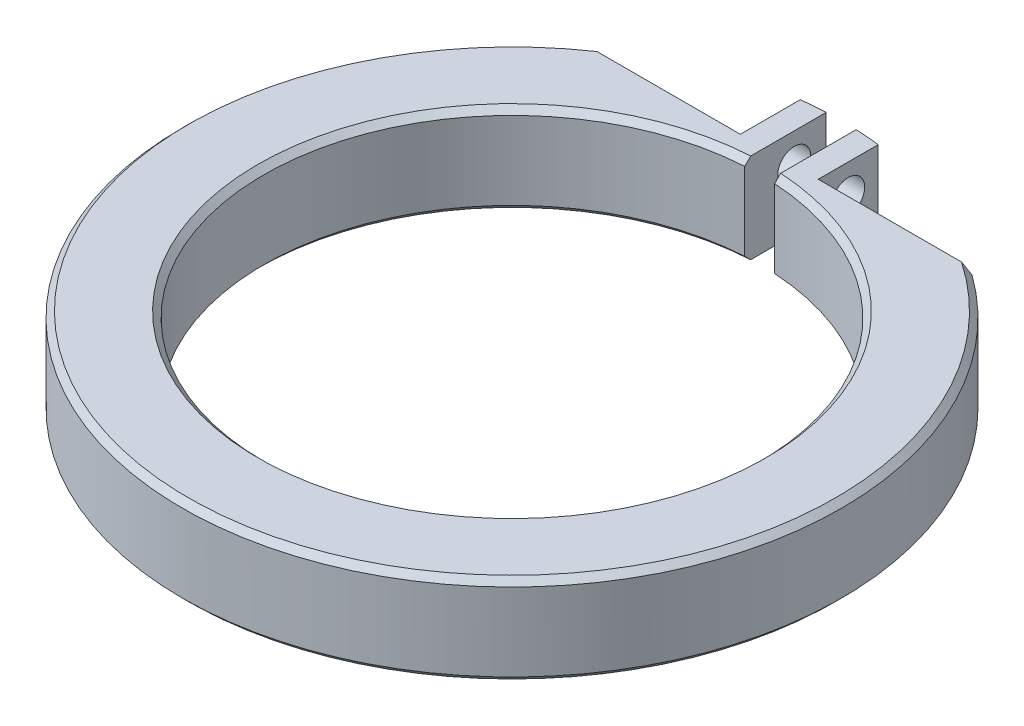
from build123d import *

# Parameters (mm, degrees)
SKETCH1_R           = 55
SKETCH1_R_2         = 41.4175
BOSS_EXTRUDE1_DEPTH = 15
CUT_EXTRUDE1_DEPTH  = 80.214897589
CUT_EXTRUDE2_START  = -10
CUT_EXTRUDE2_DEPTH  = 10
SKETCH4_R           = 2.75
CUT_EXTRUDE3_DEPTH  = 84.858511792
FILLET2_R           = 2
CHAMFER2_SIZE       = 1
CHAMFER3_SIZE       = 1


with BuildPart() as part:
    # Sketch1 → Boss-Extrude1 (new body)
    with BuildSketch(Plane(origin=(0, 0, 0), x_dir=(1, 0, 0), z_dir=(0, 1, 0))):
        with Locations(Location((0, 0, 0), (0, 0, 270))):
            Circle(SKETCH1_R)
        with Locations(Location((0, 0, 0), (0, 0, 270))):
            Circle(SKETCH1_R_2, mode=Mode.SUBTRACT)
    extrude(amount=BOSS_EXTRUDE1_DEPTH)

    # Sketch2 → Cut-Extrude1 (cut, through all)
    with BuildSketch(Plane(origin=(0, 15, 0), x_dir=(1, 0, 0), z_dir=(0, 1, 0))):
        with BuildLine():
            Line((-2.5, 41.341979951), (-2.5, 54.94315244))
            ThreePointArc((-2.5, 54.94315244), (0, 55), (2.5, 54.94315244))
            Line((2.5, 54.94315244), (2.5, 41.341979951))
            ThreePointArc((2.5, 41.341979951), (0, 41.4175), (-2.5, 41.341979951))
        make_face()
    extrude(amount=-CUT_EXTRUDE1_DEPTH, mode=Mode.SUBTRACT)

    # Sketch3 → Cut-Extrude2 (cut)
    with BuildSketch(Plane(origin=(0, 15, 0), x_dir=(1, 0, 0), z_dir=(0, 1, 0)).offset(CUT_EXTRUDE2_START)):
        with BuildLine():
            Line((-6.5, 54.614558499), (-6.5, 44.614558499))
            Line((-6.5, 44.614558499), (-32.164284074, 44.614558499))
            ThreePointArc((-32.164284074, 44.614558499), (-19.96826772, 51.247129522), (-6.5, 54.614558499))
        make_face()
        with BuildLine():
            Line((6.5, 44.614558499), (32.164284074, 44.614558499))
            ThreePointArc((32.164284074, 44.614558499), (19.96826772, 51.247129522), (6.5, 54.614558499))
            Line((6.5, 54.614558499), (6.5, 44.614558499))
        make_face()
    extrude(amount=CUT_EXTRUDE2_DEPTH, mode=Mode.SUBTRACT)

    # Sketch4 → Cut-Extrude3 (cut, through all)
    with BuildSketch(Plane.ZY.offset(6.5)):
        with Locations((-49.614558499, 10)):
            Circle(SKETCH4_R)
    extrude(amount=-CUT_EXTRUDE3_DEPTH, mode=Mode.SUBTRACT)

    # Fillet2
    fillet2_edges = [part.edges().sort_by_distance(p)[0] for p in [
        (-19.332142037, 5, -44.614558499),
        (19.332142037, 5, -44.614558499),
    ]]
    fillet(fillet2_edges, radius=FILLET2_R)

    # Chamfer2
    chamfer2_edges = [part.edges().sort_by_distance(p)[0] for p in [
        (0, 0, 55),
        (0, 15, 55),
    ]]
    chamfer(chamfer2_edges, length=CHAMFER2_SIZE)

    # Chamfer3
    chamfer3_edges = [part.edges().sort_by_distance(p)[0] for p in [
        (-41.398615683, 0, 1.250570198),
        (41.398615683, 15, 1.250570198),
    ]]
    chamfer(chamfer3_edges, length=CHAMFER3_SIZE)


solid = part.part
